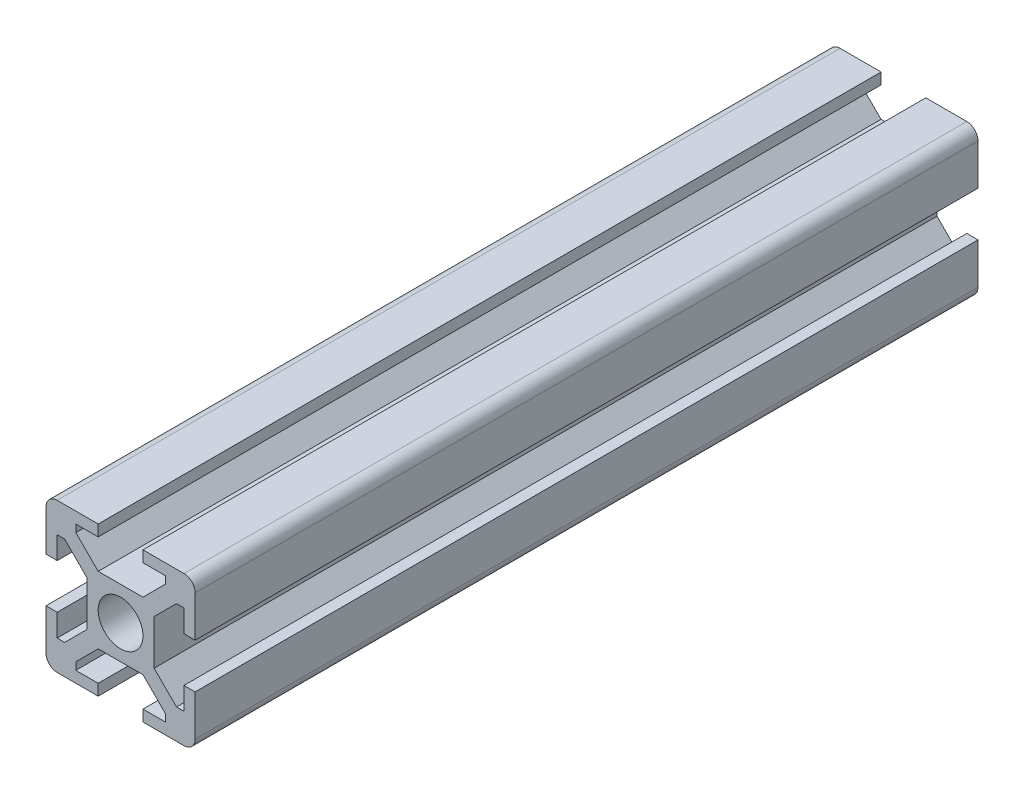
from build123d import *

# Parameters (mm, degrees)
ESQUISSE1_W                  = 20
ESQUISSE1_H                  = 20
EXTRUSION1_DEPTH             = 52.5
CONG_1_R                     = 1.5
ENL_V_MAT_EXTRU_1_DEPTH      = 106.948100502
R_P_TITION_CIRCULAIRE1_COUNT = 4


with BuildPart() as part:
    # Esquisse1 → Extrusion1 (new, symmetric)
    with BuildSketch(Plane.XY):
        Rectangle(ESQUISSE1_W, ESQUISSE1_H)
    extrude(amount=EXTRUSION1_DEPTH, both=True)

    # Congé1
    cong_1_edges = [part.edges().sort_by_distance(p)[0] for p in [
        (-10, -10, 0),
        (10, -10, 0),
        (-10, 10, 0),
        (10, 10, 0),
    ]]
    fillet(cong_1_edges, radius=CONG_1_R)

    # Esquisse2 → Enlèv. mat.-Extru.1 (cut, through all)
    with BuildSketch(Plane(origin=(0, 0, -52.5), x_dir=(-1, 0, 0), z_dir=(0, 0, -1))):
        Polygon((-10, 3), (-10, -3), (-8.5, -3), (-8.5, -6), (-7.5, -6), (-4.5, -3), (-4.5, 3), (-7.5, 6), (-8.5, 6), (-8.5, 3), align=None)
    enl_v_mat_extru_1 = extrude(amount=-ENL_V_MAT_EXTRU_1_DEPTH, mode=Mode.SUBTRACT)

    # Répétition circulaire1: Enlèv. mat.-Extru.1 ×4 about axis
    r_p_tition_circulaire1_axis = Axis((0, 0, 9.333809512), (0, 0, -1))
    for i in range(1, R_P_TITION_CIRCULAIRE1_COUNT):
        add(enl_v_mat_extru_1.rotate(r_p_tition_circulaire1_axis, i * 360 / R_P_TITION_CIRCULAIRE1_COUNT), mode=Mode.SUBTRACT)

    # Esquisse5 → Trou taraudé M6x1.01 (revolve, cut)
    with BuildSketch(Plane(origin=(0, 0, -52.5), x_dir=(0, 1, 0), z_dir=(1, 0, 0))):
        Polygon((0, 0), (0, 31.502151548), (2.5, 30), (2.5, 24), (3, 24), (3, 0), align=None)
    trou_taraud_m6x1_01 = revolve(axis=Axis((0, 0, -58.85), (0, 0, 1)), mode=Mode.SUBTRACT)

    # Symétrie1: Trou taraudé M6x1.01 across plane
    add(trou_taraud_m6x1_01.mirror(Plane.XY), mode=Mode.SUBTRACT)


solid = part.part
